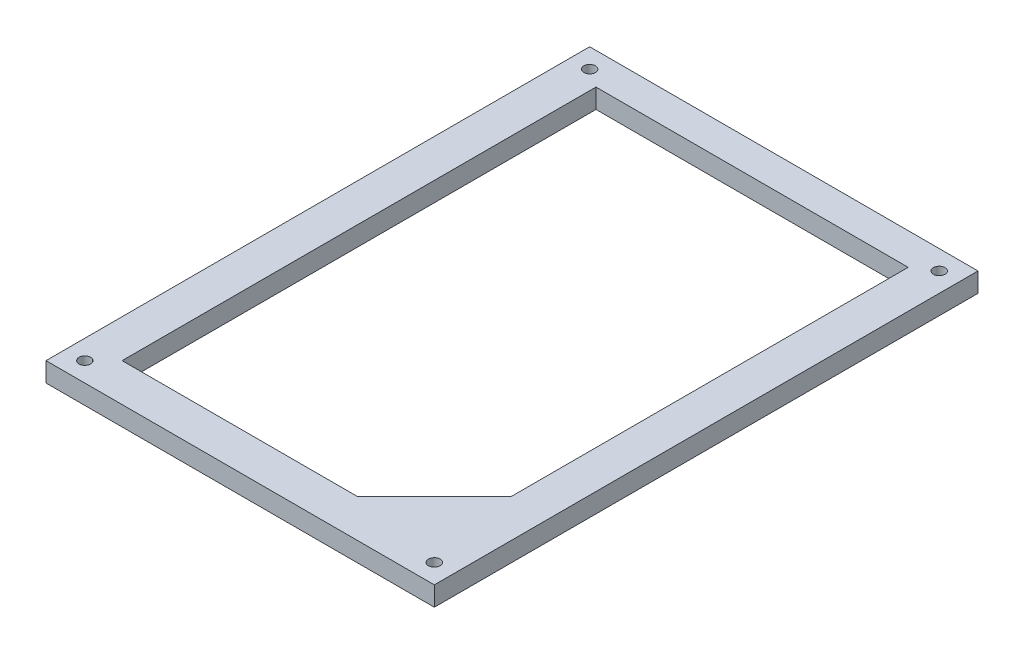
from build123d import *

# Parameters (mm, degrees)
SKETCH1_W           = 127
SKETCH1_H           = 177.8
BOSS_EXTRUDE1_DEPTH = 6.35
CUT_EXTRUDE1_DEPTH  = 219.591313871
SKETCH3_R           = 1.905
CUT_EXTRUDE2_DEPTH  = 219.591313871


with BuildPart() as part:
    # Sketch1 → Boss-Extrude1 (new body)
    with BuildSketch(Plane(origin=(0, 0, 0), x_dir=(1, 0, 0), z_dir=(0, 1, 0))):
        with Locations((63.5, 88.9)):
            Rectangle(SKETCH1_W, SKETCH1_H)
    extrude(amount=BOSS_EXTRUDE1_DEPTH)

    # Sketch2 → Cut-Extrude1 (cut, through all)
    with BuildSketch(Plane(origin=(0, 6.35, 0), x_dir=(1, 0, 0), z_dir=(0, 1, 0))):
        Polygon((114.554, 167.411684877), (12.446, 167.411684877), (12.446, 12.446), (89.408, 12.446), (114.554, 37.592), align=None)
    extrude(amount=-CUT_EXTRUDE1_DEPTH, mode=Mode.SUBTRACT)

    # Sketch3 → Cut-Extrude2 (cut, through all)
    with BuildSketch(Plane(origin=(0, 6.35, 0), x_dir=(1, 0, 0), z_dir=(0, 1, 0))):
        with Locations(Location((6.35, 171.45, 0), (0, 0, 270))):
            Circle(SKETCH3_R)
        with Locations(Location((6.35, 6.35, 0), (0, 0, 90))):
            Circle(SKETCH3_R)
        with Locations(Location((120.65, 6.35, 0), (0, 0, 270))):
            Circle(SKETCH3_R)
        with Locations(Location((120.65, 171.45, 0), (0, 0, 90))):
            Circle(SKETCH3_R)
    extrude(amount=-CUT_EXTRUDE2_DEPTH, mode=Mode.SUBTRACT)


solid = part.part
